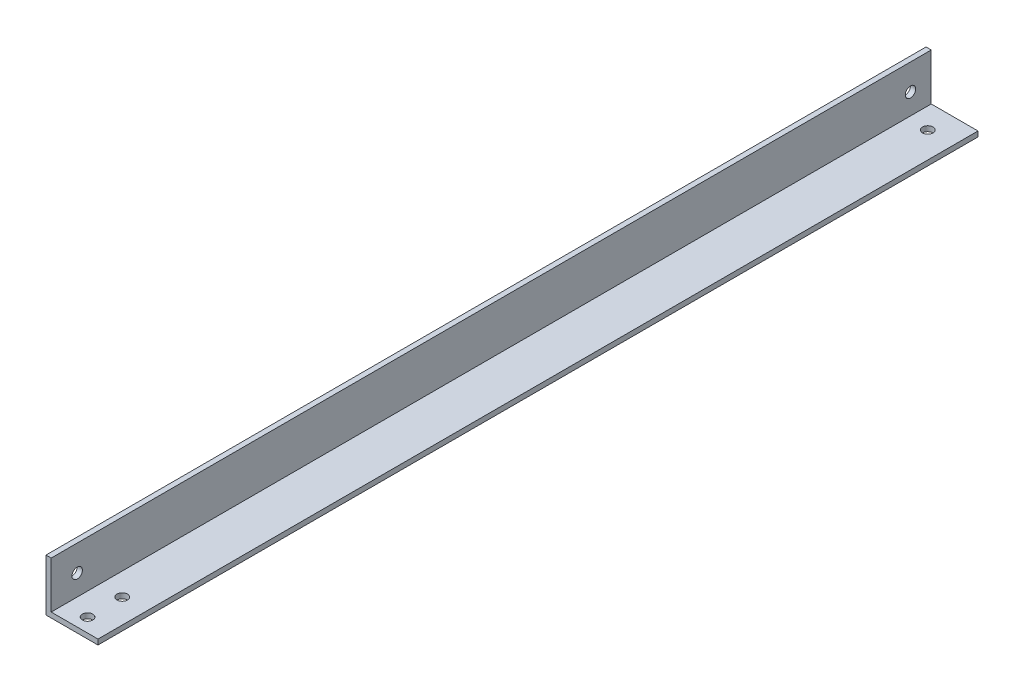
from build123d import *

# Parameters (mm, degrees)
EXTRUSION1_DEPTH = 254
ESQUISSE2_R      = 1.5
EXTRUSION2_DEPTH = 186
ESQUISSE3_R      = 1.5
EXTRUSION3_DEPTH = 186


with BuildPart() as part:
    # Esquisse1 → Extrusion1 (new body)
    with BuildSketch(Plane.XY):
        Polygon((-21.235396624, -5.627388535), (-21.235396624, -20.627388535), (-6.235396624, -20.627388535), (-6.235396624, -19.127388535), (-19.735396624, -19.127388535), (-19.735396624, -5.627388535), align=None)
    extrude(amount=EXTRUSION1_DEPTH)

    # Esquisse2 → Extrusion2 (cut)
    with BuildSketch(Plane(origin=(0, -19.127388535, 0), x_dir=(-1, 0, 0), z_dir=(0, 1, 0))):
        with Locations(Location((13.735396624, 7, 0), (0, 0, 90))):
            Circle(ESQUISSE2_R)
        with Locations(Location((13.235396624, 250, 0), (0, 0, 90))):
            Circle(ESQUISSE2_R)
        with Locations(Location((13.235396624, 240, 0), (0, 0, 90))):
            Circle(ESQUISSE2_R)
    extrude(amount=-EXTRUSION2_DEPTH, mode=Mode.SUBTRACT)

    # Esquisse3 → Extrusion3 (cut)
    with BuildSketch(Plane(origin=(-19.735396624, 0, 0), x_dir=(0, 0, -1), z_dir=(1, 0, 0))):
        with Locations((-6, -13.127388535)):
            Circle(ESQUISSE3_R)
        with Locations((-246.5, -13.127388535)):
            Circle(ESQUISSE3_R)
    extrude(amount=-EXTRUSION3_DEPTH, mode=Mode.SUBTRACT)


solid = part.part
